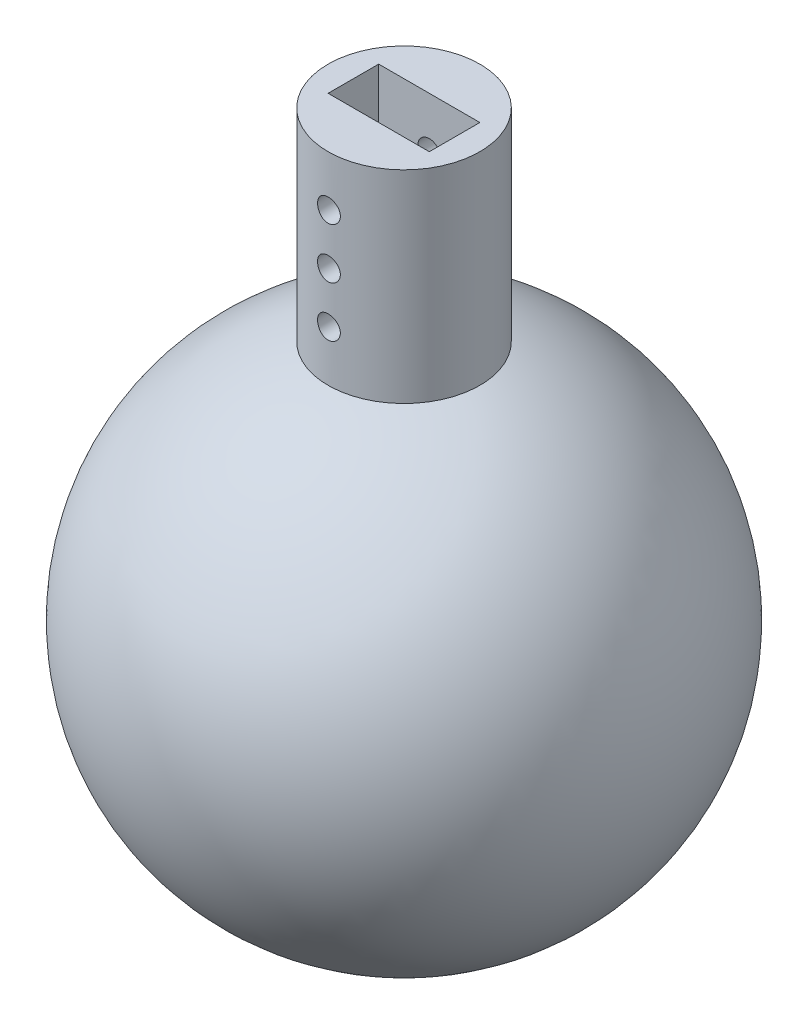
from build123d import *

# Parameters (mm, degrees)
CUT_EXTRUDE1_DEPTH      = 15
CUT_EXTRUDE1_DEPTH_BACK = 15
SKETCH2_R               = 2.25
SKETCH3_W               = 20
SKETCH3_H               = 10
CUT_EXTRUDE2_DEPTH      = 40


with BuildPart() as part:
    # Sketch1 → Revolve1 (revolve)
    with BuildSketch(Plane.XY):
        with BuildLine():
            Line((0, 0), (0, 40))
            Line((0, 40), (15, 40))
            Line((15, 40), (15, -47.696960071))
            Line((15, -47.696960071), (15, -97.696960071))
            ThreePointArc((15, -97.696960071), (-34.420886291, -55.284845035), (0, 0))
        make_face()
    revolve(axis=Axis((15, 40, 0), (0, -1, 0)))

    # Sketch2 → Cut-Extrude1 (cut, two sides: drawn at the far end of the back side and taken through both)
    with BuildSketch(Plane.XY.offset(-CUT_EXTRUDE1_DEPTH_BACK)):
        with Locations(Location((15, 30, 0), (0, 0, 180))):
            Circle(SKETCH2_R)
        with Locations(Location((15, 20, 0), (0, 0, 180))):
            Circle(SKETCH2_R)
        with Locations(Location((15, 10, 0), (0, 0, 180))):
            Circle(SKETCH2_R)
    extrude(amount=CUT_EXTRUDE1_DEPTH + CUT_EXTRUDE1_DEPTH_BACK, mode=Mode.SUBTRACT)

    # Sketch3 → Cut-Extrude2 (cut)
    with BuildSketch(Plane(origin=(0, 40, 0), x_dir=(1, 0, 0), z_dir=(0, 1, 0))):
        with Locations((15, 0)):
            Rectangle(SKETCH3_W, SKETCH3_H)
    extrude(amount=-CUT_EXTRUDE2_DEPTH, mode=Mode.SUBTRACT)


solid = part.part
